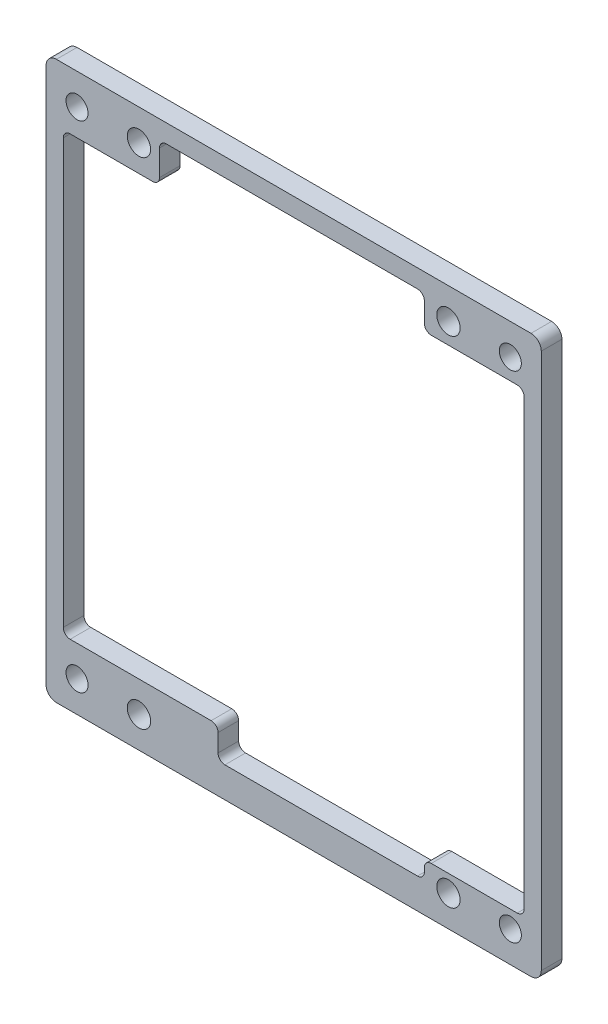
from build123d import *

# Parameters (mm, degrees)
MODEL_R                 = 1.7
MODEL_R_2               = 1.600279216
SALIENTE_EXTRUIR1_DEPTH = 3


with BuildPart() as part:
    # Model → Saliente-Extruir1 (new body)
    with BuildSketch(Plane.XY):
        with BuildLine():
            Line((74.679802956, 300.758040435), (5.677398721, 300.758040435))
            ThreePointArc((5.677398721, 300.758040435), (4.61673855, 300.318700606), (4.177398721, 299.258040435))
            Line((4.177398721, 299.258040435), (4.177398721, 221.253430577))
            ThreePointArc((4.177398721, 221.253430577), (4.61673855, 220.192770405), (5.677398721, 219.753430577))
            Line((5.677398721, 219.753430577), (74.679802956, 219.753430577))
            ThreePointArc((74.679802956, 219.753430577), (75.740463127, 220.192770405), (76.179802956, 221.253430577))
            Line((76.179802956, 221.253430577), (76.179802956, 299.258040435))
            ThreePointArc((76.179802956, 299.258040435), (75.740463127, 300.318700606), (74.679802956, 300.758040435))
        make_face()
        with Locations((17.676729717, 224.253096075)):
            Circle(MODEL_R, mode=Mode.SUBTRACT)
        with Locations((62.680137458, 224.253096075)):
            Circle(MODEL_R, mode=Mode.SUBTRACT)
        with Locations((8.677064219, 224.253096075)):
            Circle(MODEL_R_2, mode=Mode.SUBTRACT)
        with Locations((71.679802956, 224.253096075)):
            Circle(MODEL_R_2, mode=Mode.SUBTRACT)
        with Locations((17.676729717, 296.258040435)):
            Circle(MODEL_R, mode=Mode.SUBTRACT)
        with Locations((62.680137458, 296.258040435)):
            Circle(MODEL_R, mode=Mode.SUBTRACT)
        with Locations((71.679802956, 296.258040435)):
            Circle(MODEL_R_2, mode=Mode.SUBTRACT)
        with Locations((8.677064219, 296.258040435)):
            Circle(MODEL_R_2, mode=Mode.SUBTRACT)
        with BuildLine():
            Line((73.679621744, 292.260238845), (73.679621744, 227.755628988))
            ThreePointArc((73.679621744, 227.755628988), (73.386728525, 227.048522207), (72.679621744, 226.755628988))
            Line((72.679621744, 226.755628988), (60.179621744, 226.755628988))
            ThreePointArc((60.179621744, 226.755628988), (59.472514963, 226.462735769), (59.179621744, 225.755628988))
            Line((59.179621744, 225.755628988), (59.179621744, 225.165628988))
            ThreePointArc((59.179621744, 225.165628988), (58.886728525, 224.458522207), (58.179621744, 224.165628988))
            Line((58.179621744, 224.165628988), (30.17721751, 224.165628988))
            ThreePointArc((30.17721751, 224.165628988), (29.470110728, 224.458522207), (29.17721751, 225.165628988))
            Line((29.17721751, 225.165628988), (29.17721751, 227.730037779))
            ThreePointArc((29.17721751, 227.730037779), (28.884324291, 228.43714456), (28.17721751, 228.730037779))
            Line((28.17721751, 228.730037779), (7.67721751, 228.730037779))
            ThreePointArc((7.67721751, 228.730037779), (6.970110728, 229.022930998), (6.67721751, 229.730037779))
            Line((6.67721751, 229.730037779), (6.67721751, 291.370238846))
            ThreePointArc((6.67721751, 291.370238846), (6.970110728, 292.077345627), (7.67721751, 292.370238846))
            Line((7.67721751, 292.370238846), (19.67721751, 292.370238846))
            ThreePointArc((19.67721751, 292.370238846), (20.384324291, 292.663132064), (20.67721751, 293.370238846))
            Line((20.67721751, 293.370238846), (20.67721751, 297.097066693))
            ThreePointArc((20.67721751, 297.097066693), (20.970110728, 297.804173474), (21.67721751, 298.097066693))
            Line((21.67721751, 298.097066693), (58.179621744, 298.097066693))
            ThreePointArc((58.179621744, 298.097066693), (58.886728525, 297.804173474), (59.179621744, 297.097066693))
            Line((59.179621744, 297.097066693), (59.179621744, 294.260238845))
            ThreePointArc((59.179621744, 294.260238845), (59.472514963, 293.553132064), (60.179621744, 293.260238845))
            Line((60.179621744, 293.260238845), (72.679621744, 293.260238845))
            ThreePointArc((72.679621744, 293.260238845), (73.386728525, 292.967345627), (73.679621744, 292.260238845))
        make_face(mode=Mode.SUBTRACT)
    extrude(amount=SALIENTE_EXTRUIR1_DEPTH)


solid = part.part
